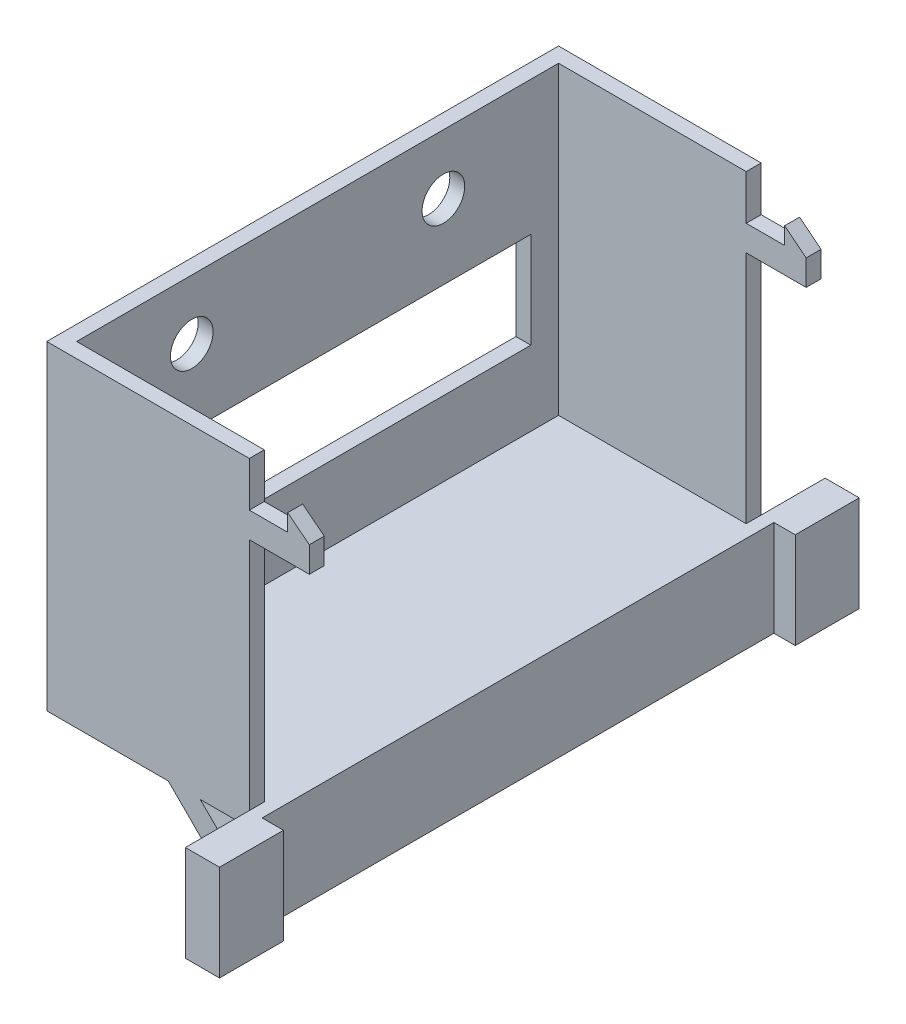
from build123d import *

# Parameters (mm, degrees)
BOSS_EXTRUDE1_DEPTH   = 4.064
BOSS_EXTRUDE1_2_DEPTH = 4.064
SKETCH1_3_W           = 60.96
SKETCH1_3_H           = 9.652
SKETCH1_3_H_2         = 1.778
BOSS_EXTRUDE2_DEPTH   = 1.524
SKETCH1_6_W           = 60.96
SKETCH1_6_H           = 1.778
BOSS_EXTRUDE3_DEPTH   = 24.13
BOSS_EXTRUDE4_DEPTH   = 38.1
BOSS_EXTRUDE7_DEPTH   = 60.96
BOSS_EXTRUDE8_DEPTH   = 60.96
CUT_EXTRUDE2_START    = -5.08
CUT_EXTRUDE2_DEPTH    = 50.8
SKETCH6_R             = 2.54
CUT_EXTRUDE3_DEPTH    = 89.450736232
BOSS_EXTRUDE9_START   = -27.94
BOSS_EXTRUDE9_DEPTH   = 5.08
BOSS_EXTRUDE10_REACH  = 83.27
CUT_EXTRUDE4_START    = -1.778
CUT_EXTRUDE4_DEPTH    = 57.404


with BuildPart() as part:
    # Sketch1 → Boss-Extrude1 (new body)
    with BuildSketch(Plane(origin=(0, 0, 0), x_dir=(0, 0, -1), z_dir=(1, 0, 0))):
        Polygon((7.62, 0), (0, 0), (0, -11.43), (7.62, -11.43), (7.62, -1.778), align=None)
    extrude(amount=BOSS_EXTRUDE1_DEPTH)



with BuildPart() as body_2:
    # Sketch1 → Boss-Extrude1 2 (new body)
    with BuildSketch(Plane(origin=(0, 0, 0), x_dir=(0, 0, -1), z_dir=(1, 0, 0))):
        Polygon((76.2, 0), (68.58, 0), (68.58, -1.778), (68.58, -11.43), (76.2, -11.43), align=None)
    extrude(amount=BOSS_EXTRUDE1_2_DEPTH)


with BuildPart() as part_1:
    add(part.part)

    add(body_2.part)  # Boss-Extrude2 merges body 2
    # Sketch1<3> → Boss-Extrude2 (add)
    with BuildSketch(Plane(origin=(0, 0, 0), x_dir=(0, 0, -1), z_dir=(1, 0, 0))):
        with Locations((38.1, -6.604)):
            Rectangle(SKETCH1_3_W, SKETCH1_3_H)
        with Locations((38.1, -0.889)):
            Rectangle(SKETCH1_3_W, SKETCH1_3_H_2)
    extrude(amount=BOSS_EXTRUDE2_DEPTH)

    # Sketch1<6> → Boss-Extrude3 (add)
    with BuildSketch(Plane(origin=(0, 0, 0), x_dir=(0, 0, -1), z_dir=(1, 0, 0))):
        with Locations((38.1, -0.889)):
            Rectangle(SKETCH1_6_W, SKETCH1_6_H)
    extrude(amount=-BOSS_EXTRUDE3_DEPTH)

    # Sketch4 → Boss-Extrude4 (add)
    with BuildSketch(Plane.XZ.offset(1.778)):
        Polygon((0, -7.62), (-24.13, -7.62), (-24.13, -68.58), (0, -68.58), (0, -66.802), (-22.352, -66.802), (-22.352, -9.398), (0, -9.398), align=None)
    extrude(amount=-BOSS_EXTRUDE4_DEPTH)

    # Sketch5<4> → Boss-Extrude7 (add)
    with BuildSketch(Plane(origin=(0, 0, -68.58), x_dir=(-1, 0, 0), z_dir=(0, 0, -1))):
        Polygon((1.778, -1.778), (0, -1.778), (0, -3.556), align=None)
    extrude(amount=-BOSS_EXTRUDE7_DEPTH)

    # Sketch5<5> → Boss-Extrude8 (add)
    with BuildSketch(Plane(origin=(0, 0, -68.58), x_dir=(-1, 0, 0), z_dir=(0, 0, -1))):
        Polygon((9.652, -1.778), (5.842, -1.778), (0, -7.62), (0, -11.43), align=None)
    extrude(amount=-BOSS_EXTRUDE8_DEPTH)

    # Sketch5 → Cut-Extrude2 (cut)
    with BuildSketch(Plane(origin=(0, 0, -68.58), x_dir=(-1, 0, 0), z_dir=(0, 0, -1)).offset(CUT_EXTRUDE2_START)):
        Polygon((9.652, -1.778), (5.842, -1.778), (0, -7.62), (0, -11.43), align=None)
    extrude(amount=-CUT_EXTRUDE2_DEPTH, mode=Mode.SUBTRACT)

    # Sketch6 → Cut-Extrude3 (cut, through all)
    with BuildSketch(Plane(origin=(-22.352, 0, 0), x_dir=(0, 0, -1), z_dir=(1, 0, 0))):
        with Locations((23.114, 29.21)):
            Circle(SKETCH6_R)
        with Locations((53.086, 29.21)):
            Circle(SKETCH6_R)
        Polygon((38.1, 20.32), (12.7, 20.32), (12.7, 8.89), (63.5, 8.89), (63.5, 20.32), align=None)
    extrude(amount=-CUT_EXTRUDE3_DEPTH, mode=Mode.SUBTRACT)

    # Sketch5<12> → Boss-Extrude9 (add)
    with BuildSketch(Plane(origin=(0, 0, -68.58), x_dir=(-1, 0, 0), z_dir=(0, 0, -1)).offset(BOSS_EXTRUDE9_START)):
        Polygon((9.652, -1.778), (5.842, -1.778), (0, -7.62), (0, -11.43), align=None)
    extrude(amount=-BOSS_EXTRUDE9_DEPTH)

    # Boss-Extrude10: up to this face of the body (flat: up to its plane)
    boss_extrude10_end = Plane(part_1.part.faces().sort_by_distance((-11.79395977, 16.525022989, -68.58))[0])
    # Sketch9 → Boss-Extrude10 (add, up to the picked face)
    with BuildSketch(Plane.XY.offset(-7.62), mode=Mode.PRIVATE) as boss_extrude10_sk1:
        Polygon((0, 27.94), (0, 30.988), (4.572, 30.988), (4.572, 33.02), (7.140253406, 30.988), (7.140253406, 27.94), align=None)
    boss_extrude10_tool1 = split(extrude(boss_extrude10_sk1.sketch, amount=-BOSS_EXTRUDE10_REACH, mode=Mode.PRIVATE), bisect_by=boss_extrude10_end, keep=Keep.BOTH, mode=Mode.PRIVATE)
    add(boss_extrude10_tool1.solids().sort_by(Axis((3.769039, 29.699674, -7.62), (0, 0, -1)))[0])

    # Sketch9<2> → Cut-Extrude4 (cut)
    with BuildSketch(Plane.XY.offset(-7.62).offset(CUT_EXTRUDE4_START)):
        Polygon((0, 27.94), (0, 30.988), (4.572, 30.988), (4.572, 33.02), (7.140253406, 30.988), (7.140253406, 27.94), align=None)
    extrude(amount=-CUT_EXTRUDE4_DEPTH, mode=Mode.SUBTRACT)


solid = part_1.part
